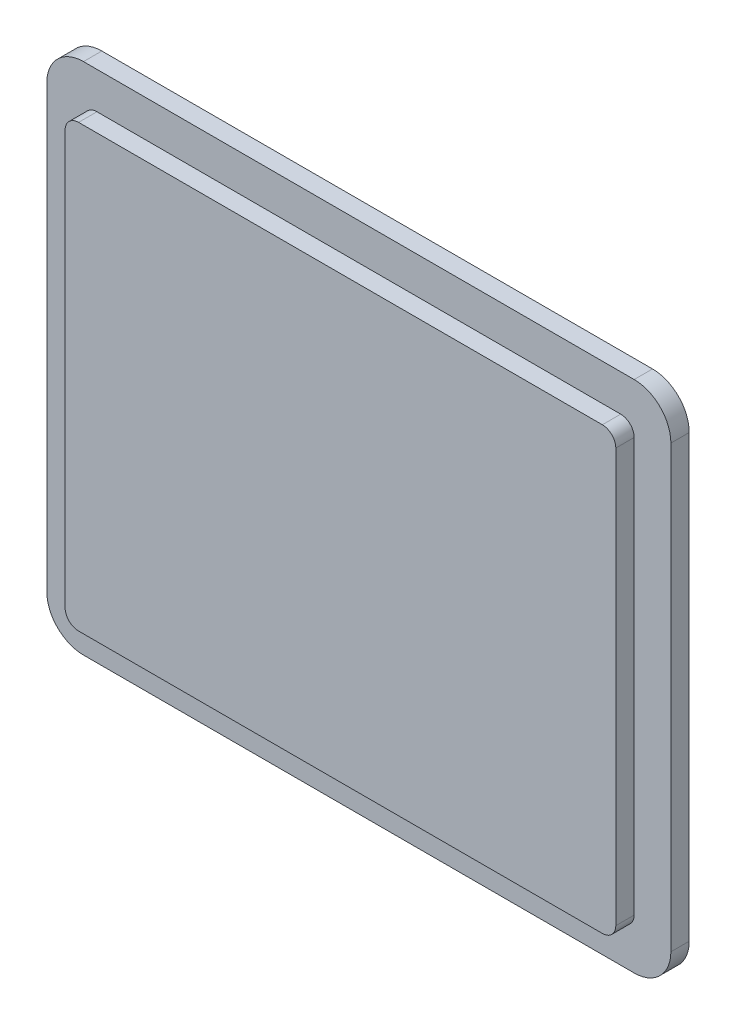
from build123d import *

# Parameters (mm, degrees)
EXTRUDE_1_DEPTH     = 3
SKETCH_2_OUTSIDE_W  = 66.228
SKETCH_2_OUTSIDE_H  = 57.228
CUT_EXTRUDE_1_DEPTH = 1.5


with BuildPart() as part:
    # 草图1 → 凸台-拉伸1 (new body)
    with BuildSketch(Plane.XY):
        with BuildLine():
            Line((3, 0), (48, 0))
            ThreePointArc((48, 0), (50.121320344, 0.878679656), (51, 3))
            Line((51, 3), (51, 39))
            ThreePointArc((51, 39), (50.121320344, 41.121320344), (48, 42))
            Line((48, 42), (3, 42))
            ThreePointArc((3, 42), (0.878679656, 41.121320344), (0, 39))
            Line((0, 39), (0, 3))
            ThreePointArc((0, 3), (0.878679656, 0.878679656), (3, 0))
        make_face()
    extrude(amount=EXTRUDE_1_DEPTH)

    # 草图2 outside → 切除-拉伸1 (cut)
    with BuildSketch(Plane.XY.offset(3)):
        with Locations((25.5, 21)):
            Rectangle(SKETCH_2_OUTSIDE_W, SKETCH_2_OUTSIDE_H)
        with BuildLine():
            Line((4.1, 39), (46.9, 39))
            ThreePointArc((46.9, 39), (47.677817459, 38.677817459), (48, 37.9))
            Line((48, 37.9), (48, 4.1))
            ThreePointArc((48, 4.1), (47.677817459, 3.322182541), (46.9, 3))
            Line((46.9, 3), (4.1, 3))
            ThreePointArc((4.1, 3), (3.322182541, 3.322182541), (3, 4.1))
            Line((3, 4.1), (3, 37.9))
            ThreePointArc((3, 37.9), (3.322182541, 38.677817459), (4.1, 39))
        make_face(mode=Mode.SUBTRACT)
    extrude(amount=-CUT_EXTRUDE_1_DEPTH, mode=Mode.SUBTRACT)


solid = part.part
